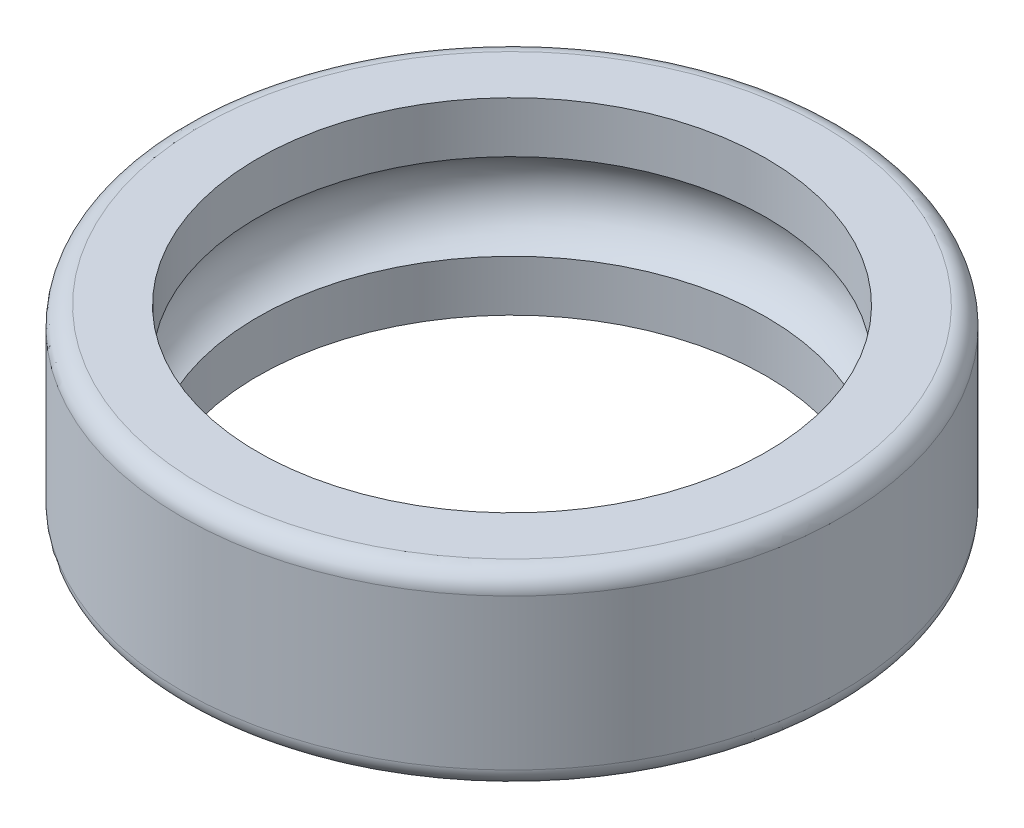
from build123d import *


with BuildPart() as part:
    # Sketch1 → Revolve1 (revolve)
    with BuildSketch(Plane.YZ, mode=Mode.PRIVATE) as revolve1_sk:
        with BuildLine():
            Line((-4, 17.5), (4, 17.5))
            ThreePointArc((4, 17.5), (4.707106781, 17.207106781), (5, 16.5))
            Line((5, 16.5), (5, 13.5))
            Line((5, 13.5), (2.291287847, 13.5))
            ThreePointArc((2.291287847, 13.5), (0, 15), (-2.291287847, 13.5))
            Line((-2.291287847, 13.5), (-5, 13.5))
            Line((-5, 13.5), (-5, 16.5))
            ThreePointArc((-5, 16.5), (-4.707106781, 17.207106781), (-4, 17.5))
        make_face()
    revolve(revolve1_sk.sketch.rotate(Axis((0, -30.435284328, 0), (0, 1, 0)), 180), axis=Axis((0, -30.435284328, 0), (0, 1, 0)))


solid = part.part
